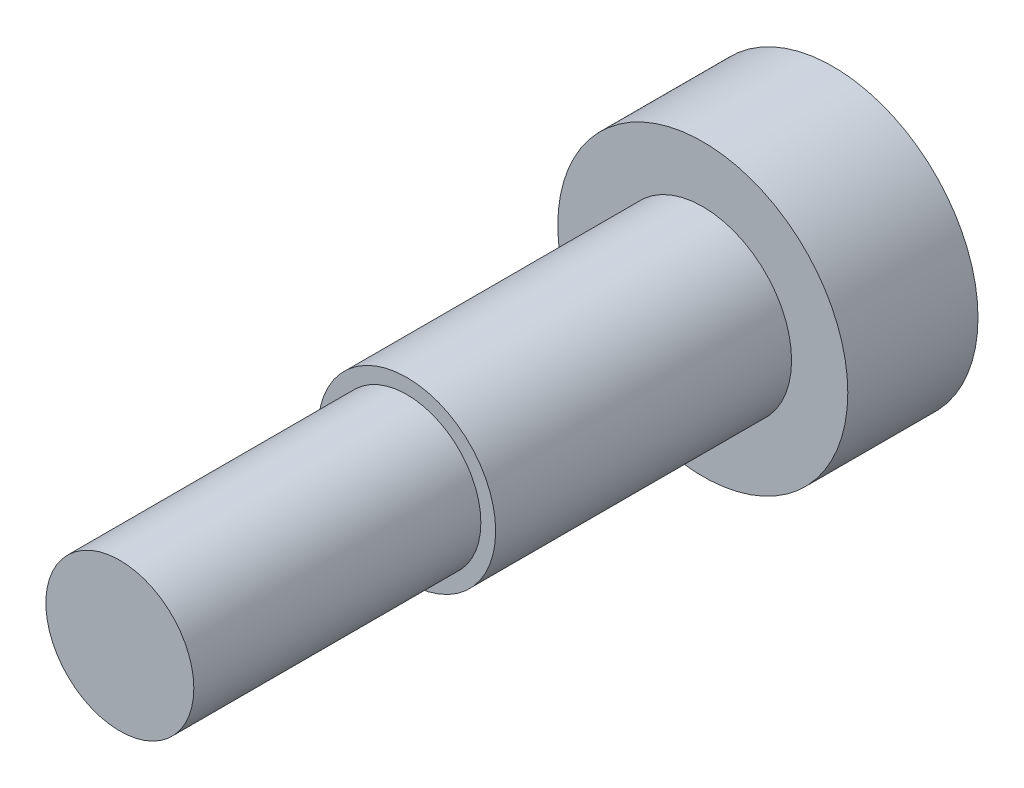
from build123d import *

# Parameters (mm, degrees)
SKETCH_1_R          = 4.9
EXTRUDE_1_DEPTH     = 4.4
SKETCH_2_R          = 3
EXTRUDE_2_DEPTH     = 10
SKETCH_3_R          = 2.5
EXTRUDE_3_DEPTH     = 9.7
CUT_EXTRUDE_1_DEPTH = 2


with BuildPart() as part:
    # 草图1 → 凸台-拉伸1 (new body)
    with BuildSketch(Plane.XY):
        Circle(SKETCH_1_R)
    extrude(amount=EXTRUDE_1_DEPTH)

    # 草图2 → 凸台-拉伸2 (add)
    with BuildSketch(Plane.XY.offset(4.4)):
        Circle(SKETCH_2_R)
    extrude(amount=EXTRUDE_2_DEPTH)

    # 草图3 → 凸台-拉伸3 (add)
    with BuildSketch(Plane.XY.offset(14.4)):
        Circle(SKETCH_3_R)
    extrude(amount=EXTRUDE_3_DEPTH)

    # 草图4 → 切除-拉伸1 (cut)
    with BuildSketch(Plane(origin=(0, 0, 0), x_dir=(-1, 0, 0), z_dir=(0, 0, -1))):
        Polygon((0, 1.732050808), (-1.5, 0.866025404), (-1.5, -0.866025404), (0, -1.732050808), (1.5, -0.866025404), (1.5, 0.866025404), align=None)
    extrude(amount=-CUT_EXTRUDE_1_DEPTH, mode=Mode.SUBTRACT)


solid = part.part
